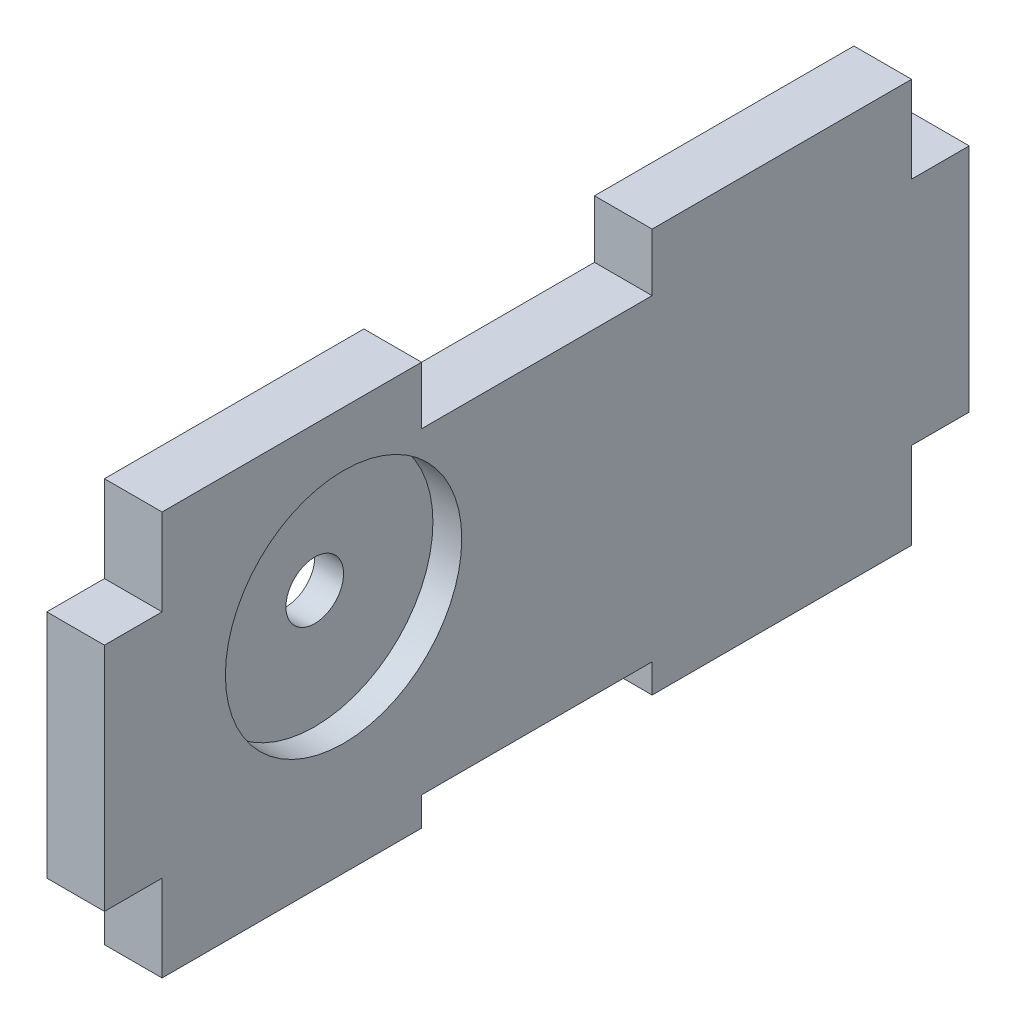
from build123d import *

# Parameters (mm, degrees)
BOSS_EXTRUDE1_DEPTH = 10
SKETCH2_R           = 20.5
CUT_EXTRUDE1_DEPTH  = 5
SKETCH4_R           = 5
CUT_EXTRUDE3_DEPTH  = 166.604951617
SKETCH5_R           = 5
CUT_EXTRUDE4_DEPTH  = 5


with BuildPart() as part:
    # Sketch1 → Boss-Extrude1 (new body)
    with BuildSketch(Plane(origin=(0, 0, 0), x_dir=(0, 0, -1), z_dir=(1, 0, 0))):
        Polygon((-95, 70), (-140, 70), (-140, 55), (-150, 55), (-150, 15), (-140, 15), (-140, 0), (-95, 0), (-95, 5), (-55, 5), (-55, 0), (-10, 0), (-10, 15), (0, 15), (0, 55), (-10, 55), (-10, 70), (-55, 70), (-55, 60), (-95, 60), align=None)
    extrude(amount=BOSS_EXTRUDE1_DEPTH)

    # Sketch2 → Cut-Extrude1 (cut)
    with BuildSketch(Plane(origin=(10, 0, 0), x_dir=(0, 0, -1), z_dir=(1, 0, 0))):
        with Locations((-108.52, 40)):
            Circle(SKETCH2_R)
    extrude(amount=-CUT_EXTRUDE1_DEPTH, mode=Mode.SUBTRACT)

    # Sketch4 → Cut-Extrude3 (cut, through all)
    with BuildSketch(Plane(origin=(5, 0, 0), x_dir=(0, 0, -1), z_dir=(1, 0, 0))):
        with Locations((-108.52, 40)):
            Circle(SKETCH4_R)
    extrude(amount=-CUT_EXTRUDE3_DEPTH, mode=Mode.SUBTRACT)

    # Sketch5 → Cut-Extrude4 (cut)
    with BuildSketch(Plane.ZY):
        with Locations((37.080096083, 26.674400393)):
            Circle(SKETCH5_R)
        with Locations((72.52, 33)):
            Circle(SKETCH5_R)
    extrude(amount=-CUT_EXTRUDE4_DEPTH, mode=Mode.SUBTRACT)


solid = part.part
